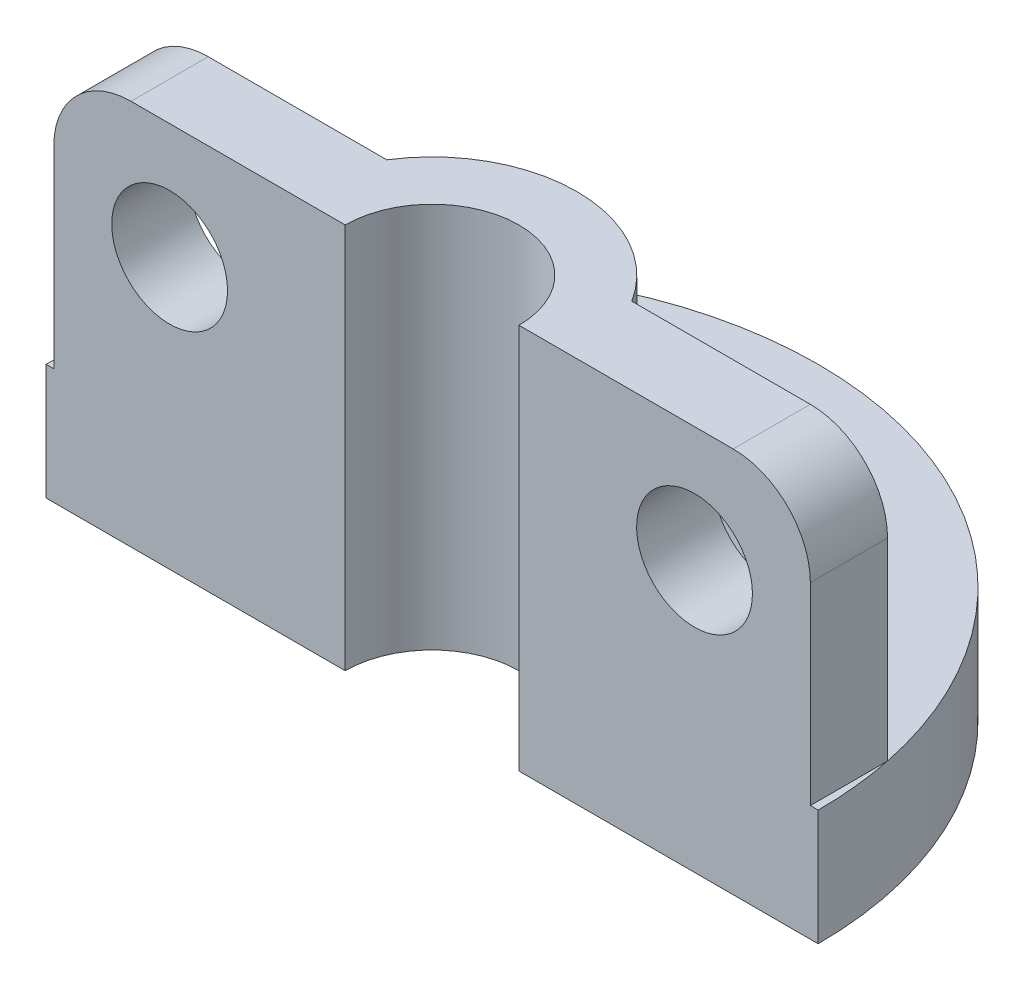
from build123d import *

# Parameters (mm, degrees)
FILLET1_R             = 3
BOSS_EXTRUDE1_REACH   = 17.78
SKETCH3_W             = 6.625814586
SKETCH3_H             = 4
SKETCH2_W             = 30
SKETCH2_H             = 15
CUT_EXTRUDE1_DEPTH    = 18.320508133
F_3_0MM_DOWEL_HOLE1_D = 3
FILLET2_R             = 2


with BuildPart() as part:
    # Sketch1 → Revolve1 (revolve)
    with BuildSketch(Plane.XY):
        Polygon((2.25, 0), (2.25, 10), (3.75, 10), (3.75, 3), (10, 3), (10, 0), align=None)
    revolve(axis=Axis((0, -739.105470896, 0), (0, 1, 0)))

    # Fillet1
    fillet1_edges = [part.edges().sort_by_distance(p)[0] for p in [
        (-3.75, 3, 0),
    ]]
    fillet(fillet1_edges, radius=FILLET1_R)

    # Boss-Extrude1: up to this face of the body (flat: up to its plane)
    boss_extrude1_end = Plane(part.part.faces().sort_by_distance((-2.356066017, 10, 0))[0])
    # Sketch3 → Boss-Extrude1 (add, up to the picked face)
    with BuildSketch(Plane(origin=(0, 3, 0), x_dir=(1, 0, 0), z_dir=(0, 1, 0)), mode=Mode.PRIVATE) as boss_extrude1_sk1:
        with Locations((-6.485051678, 0)):
            Rectangle(SKETCH3_W, SKETCH3_H)
    boss_extrude1_tool1 = split(extrude(boss_extrude1_sk1.sketch, amount=BOSS_EXTRUDE1_REACH, mode=Mode.PRIVATE), bisect_by=boss_extrude1_end, keep=Keep.BOTH, mode=Mode.PRIVATE)
    boss_extrude1 = boss_extrude1_tool1.solids().sort_by(Axis((-6.485052, 3, 0), (0, 1, 0)))[0]
    add(boss_extrude1)

    # Mirror1: Boss-Extrude1 across plane
    add(boss_extrude1.mirror(Plane(origin=(0, 0, 0), x_dir=(0, 0, 1), z_dir=(1, 0, 0))))

    # Sketch2 → Cut-Extrude1 (cut, through all)
    with BuildSketch(Plane(origin=(0, 0, 0), x_dir=(1, 0, 0), z_dir=(0, 1, 0))):
        with Locations((0, -7.5)):
            Rectangle(SKETCH2_W, SKETCH2_H)
    extrude(amount=CUT_EXTRUDE1_DEPTH, mode=Mode.SUBTRACT)

    # Ø3.0mm Dowel Hole1 (through all)
    with Locations(Plane(origin=(0, 0, -2), x_dir=(-1, 0, 0), z_dir=(0, 0, -1))):
        with Locations((6.797958971, 7), (-6.797958971, 7)):
            Hole(F_3_0MM_DOWEL_HOLE1_D / 2)

    # Fillet2
    fillet2_edges = [part.edges().sort_by_distance(p)[0] for p in [
        (-9.797958971, 10, -1),
        (9.797958971, 10, -1),
    ]]
    fillet(fillet2_edges, radius=FILLET2_R)


solid = part.part
